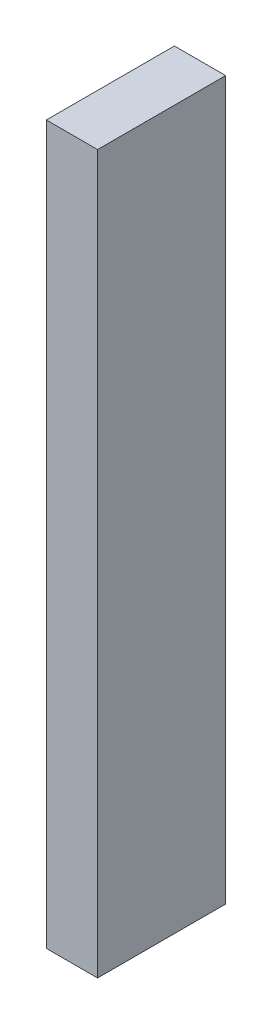
from build123d import *

# Parameters (mm, degrees)
SKETCH1_W           = 25.4
SKETCH1_H           = 63.5
BOSS_EXTRUDE1_DEPTH = 355.6


with BuildPart() as part:
    # Sketch1 → Boss-Extrude1 (new body)
    with BuildSketch(Plane(origin=(0, 0, 0), x_dir=(1, 0, 0), z_dir=(0, 1, 0))):
        with Locations((12.7, 31.75)):
            Rectangle(SKETCH1_W, SKETCH1_H)
    extrude(amount=BOSS_EXTRUDE1_DEPTH)


solid = part.part
